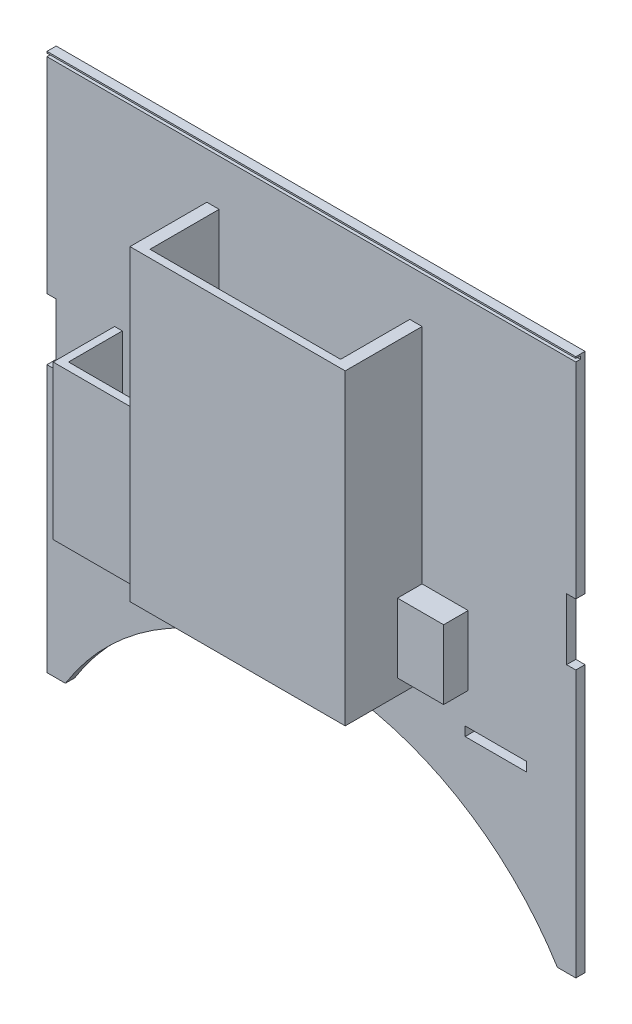
from build123d import *

# Parameters (mm, degrees)
ESQUISSE1_W             = 20
ESQUISSE1_H             = 3
BOSS_EXTRU_1_DEPTH      = 3
ESQUISSE2_W             = 172
ESQUISSE2_H             = 1
ENL_V_MAT_EXTRU_1_DEPTH = 1.5
ESQUISSE4_W             = 3
ESQUISSE4_H             = 20
ENL_V_MAT_EXTRU_2_DEPTH = 207.455986147
ESQUISSE5_W             = 70
ESQUISSE5_H             = 100
BOSS_EXTRU_2_DEPTH      = 25
ESQUISSE6_W             = 62
ESQUISSE6_H             = 22.5
ENL_V_MAT_EXTRU_3_DEPTH = 95
ESQUISSE10_W            = 30
ESQUISSE10_H            = 50
BOSS_EXTRU_3_DEPTH      = 20
ESQUISSE11_W            = 25
ESQUISSE11_H            = 17.5
ENL_V_MAT_EXTRU_5_DEPTH = 47
ESQUISSE12_W            = 8
ESQUISSE12_H            = 22.5
BOSS_EXTRU_5_DEPTH      = 15
ESQUISSE15_W            = 7.5
ESQUISSE15_H            = 20
ENL_V_MAT_EXTRU_7_DEPTH = 15
ENL_V_MAT_EXTRU_8_REACH = 210.324
ESQUISSE17_W            = 9
ESQUISSE17_H            = 15
ENL_V_MAT_EXTRU_9_DEPTH = 10


with BuildPart() as part:
    # Esquisse1 → Boss.-Extru.1 (new body)
    with BuildSketch(Plane.XY):
        with BuildLine():
            Line((-109.499197329, 0), (62.500802671, 0))
            Line((62.500802671, 0), (62.500802671, -175))
            Line((62.500802671, -175), (56.500802671, -175))
            ThreePointArc((56.500802671, -175), (-23.499197329, -130.484780132), (-103.499197329, -175))
            Line((-103.499197329, -175), (-109.499197329, -175))
            Line((-109.499197329, -175), (-109.499197329, 0))
        make_face()
        with Locations((-83.499197329, -123.5)):
            Rectangle(ESQUISSE1_W, ESQUISSE1_H, mode=Mode.SUBTRACT)
        with Locations((-23.499197329, -123.5)):
            Rectangle(ESQUISSE1_W, ESQUISSE1_H, mode=Mode.SUBTRACT)
        with Locations((36.500802671, -123.5)):
            Rectangle(ESQUISSE1_W, ESQUISSE1_H, mode=Mode.SUBTRACT)
    extrude(amount=BOSS_EXTRU_1_DEPTH)

    # Esquisse2 → Enlèv. mat.-Extru.1 (cut)
    with BuildSketch(Plane.XY.offset(3)):
        with Locations((-23.499197329, -1)):
            Rectangle(ESQUISSE2_W, ESQUISSE2_H)
    extrude(amount=-ENL_V_MAT_EXTRU_1_DEPTH, mode=Mode.SUBTRACT)

    # Esquisse4 → Enlèv. mat.-Extru.2 (cut, through all)
    with BuildSketch(Plane.XY.offset(3)):
        with Locations((-107.999197329, -78.25)):
            Rectangle(ESQUISSE4_W, ESQUISSE4_H)
        with Locations((61.000802671, -78.25)):
            Rectangle(ESQUISSE4_W, ESQUISSE4_H)
    extrude(amount=-ENL_V_MAT_EXTRU_2_DEPTH, mode=Mode.SUBTRACT)

    # Esquisse5 → Boss.-Extru.2 (add)
    with BuildSketch(Plane.XY.offset(3)):
        with Locations((-22.499197329, -66.5)):
            Rectangle(ESQUISSE5_W, ESQUISSE5_H)
    extrude(amount=BOSS_EXTRU_2_DEPTH)

    # Esquisse6 → Enlèv. mat.-Extru.3 (cut)
    with BuildSketch(Plane(origin=(0, -16.5, 0), x_dir=(1, 0, 0), z_dir=(0, 1, 0))):
        with Locations((-22.499197329, -14.25)):
            Rectangle(ESQUISSE6_W, ESQUISSE6_H)
    extrude(amount=-ENL_V_MAT_EXTRU_3_DEPTH, mode=Mode.SUBTRACT)

    # Esquisse10 → Boss.-Extru.3 (add)
    with BuildSketch(Plane.XY.offset(3)):
        with Locations((-72.499197329, -91.5)):
            Rectangle(ESQUISSE10_W, ESQUISSE10_H)
    extrude(amount=BOSS_EXTRU_3_DEPTH)

    # Esquisse11 → Enlèv. mat.-Extru.5 (cut)
    with BuildSketch(Plane(origin=(0, -66.5, 0), x_dir=(1, 0, 0), z_dir=(0, 1, 0))):
        with Locations((-72.499197329, -11.75)):
            Rectangle(ESQUISSE11_W, ESQUISSE11_H)
    extrude(amount=-ENL_V_MAT_EXTRU_5_DEPTH, mode=Mode.SUBTRACT)

    # Esquisse12 → Boss.-Extru.5 (add)
    with BuildSketch(Plane(origin=(12.500802671, 0, 0), x_dir=(0, 0, -1), z_dir=(1, 0, 0))):
        with Locations((-7, -100.25)):
            Rectangle(ESQUISSE12_W, ESQUISSE12_H)
    extrude(amount=BOSS_EXTRU_5_DEPTH)

    # Esquisse15 → Enlèv. mat.-Extru.7 (cut)
    with BuildSketch(Plane.ZY.offset(-8.500802671)):
        with Locations((6.75, -100.25)):
            Rectangle(ESQUISSE15_W, ESQUISSE15_H)
    extrude(amount=-ENL_V_MAT_EXTRU_7_DEPTH, mode=Mode.SUBTRACT)

    # Esquisse17 → Enlèv. mat.-Extru.8 (cut, up to next)
    with BuildSketch(Plane(origin=(0, 0, 0), x_dir=(-1, 0, 0), z_dir=(0, 0, -1)), mode=Mode.PRIVATE) as enl_v_mat_extru_8_sk1:
        with Locations((-19.000802671, -99.5)):
            Rectangle(ESQUISSE17_W, ESQUISSE17_H)
    enl_v_mat_extru_8_tool1 = extrude(enl_v_mat_extru_8_sk1.sketch, amount=-ENL_V_MAT_EXTRU_8_REACH, mode=Mode.PRIVATE) & part.part
    add(enl_v_mat_extru_8_tool1.solids().sort_by_distance((19.000803, -99.5, 0))[0], mode=Mode.SUBTRACT)

    # Esquisse18 → Enlèv. mat.-Extru.9 (cut)
    with BuildSketch(Plane.XY.offset(3)):
        with BuildLine():
            ThreePointArc((-8.555469882, -131.678386461), (-22.519051553, -117.45703568), (-36.740402335, -131.420617351))
            Line((-36.740402335, -131.420617351), (-8.555469882, -131.678386461))
        make_face()
    extrude(amount=-ENL_V_MAT_EXTRU_9_DEPTH, mode=Mode.SUBTRACT)


solid = part.part
